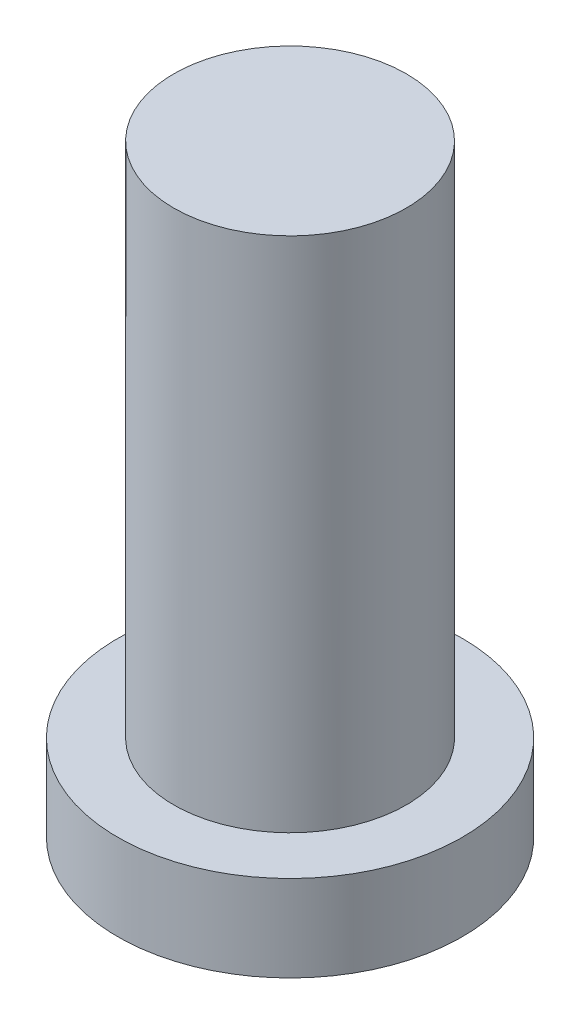
from build123d import *

# Parameters (mm, degrees)
SKETCH2_R           = 1.35
BOSS_EXTRUDE1_DEPTH = 6
SKETCH3_R           = 2
BOSS_EXTRUDE2_DEPTH = 1


with BuildPart() as part:
    # Sketch2 → Boss-Extrude1 (new body)
    with BuildSketch(Plane(origin=(0, 0, 0), x_dir=(1, 0, 0), z_dir=(0, 1, 0))):
        with Locations(Location((0, 0, 0), (0, 0, 270))):
            Circle(SKETCH2_R)
    extrude(amount=BOSS_EXTRUDE1_DEPTH)

    # Sketch3 → Boss-Extrude2 (add)
    with BuildSketch(Plane.XZ):
        with Locations(Location((0, 0, 0), (0, 0, 270))):
            Circle(SKETCH3_R)
    extrude(amount=BOSS_EXTRUDE2_DEPTH)


solid = part.part
